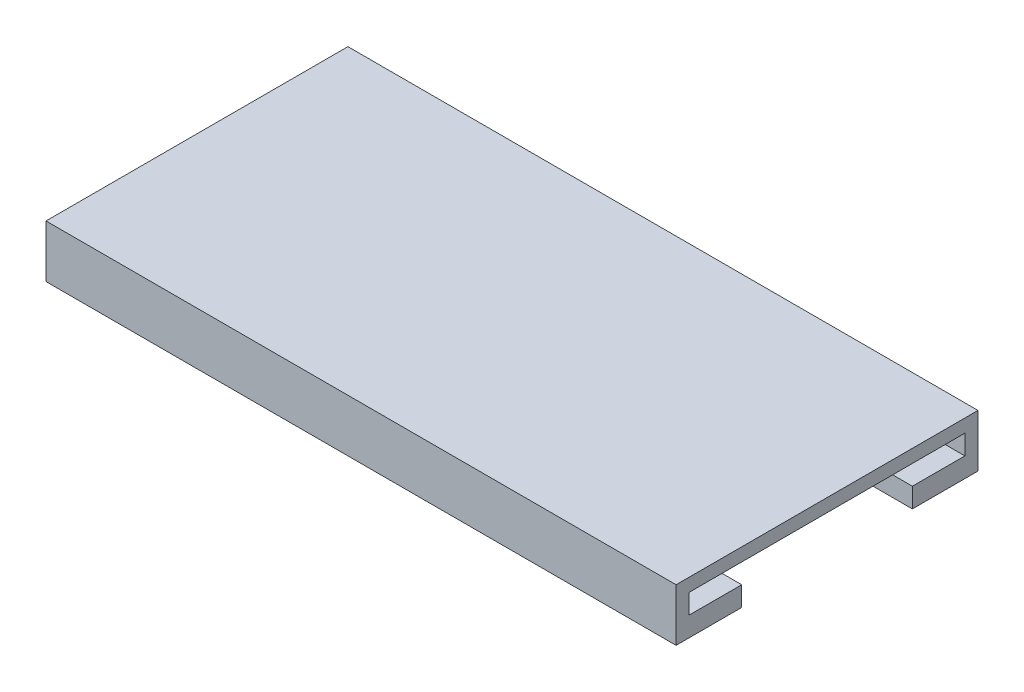
from build123d import *

# Parameters (mm, degrees)
BOSS_EXTRUDE1_DEPTH = 76.2


with BuildPart() as part:
    # Sketch1 → Boss-Extrude1 (new body)
    with BuildSketch(Plane(origin=(0, 0, 0), x_dir=(0, 0, -1), z_dir=(1, 0, 0))):
        Polygon((10.31875, -3.175), (18.25625, -3.175), (18.25625, 3.175), (-18.25625, 3.175), (-18.25625, -3.175), (-10.31875, -3.175), (-10.31875, -0.79375), (-16.66875, -0.79375), (-16.66875, 1.5875), (16.66875, 1.5875), (16.66875, -0.79375), (10.31875, -0.79375), align=None)
    extrude(amount=BOSS_EXTRUDE1_DEPTH)


solid = part.part
